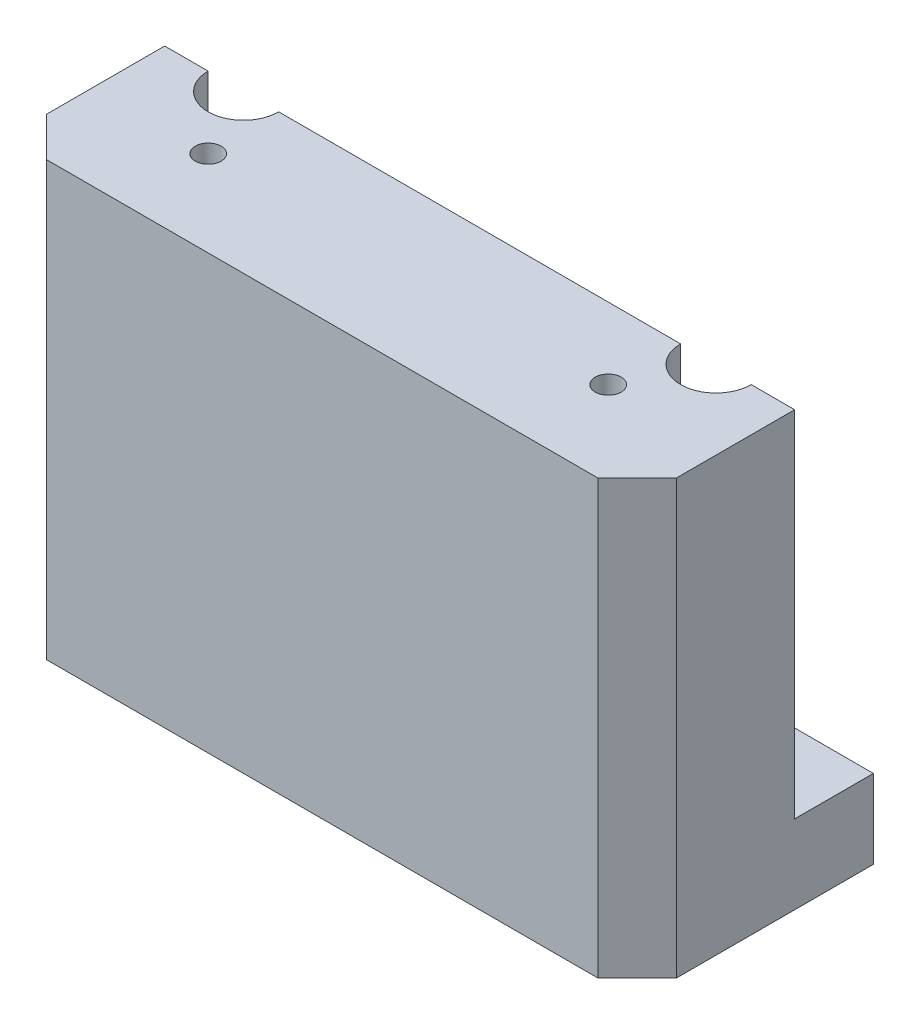
from build123d import *

# Parameters (mm, degrees)
SKETCH1_W                    = 80
SKETCH1_H                    = 30
BOSS_EXTRUDE1_DEPTH          = 55
CSK_FOR_M4_SFHCS1_AT_2_COUNT = 2
CSK_FOR_M4_SFHCS1_AT_2_PITCH = 60
M4X0_7_TAPPED_HOLE1_D        = 3.3
M4X0_7_TAPPED_HOLE1_DEPTH    = 20
M4X0_7_TAPPED_HOLE1_TIP      = 0.991420021
CHAMFER1_SIZE                = 5
SKETCH9_W                    = 80
SKETCH9_H                    = 45
CUT_EXTRUDE1_DEPTH           = 10


with BuildPart() as part:
    # Sketch1 → Boss-Extrude1 (new body)
    with BuildSketch(Plane(origin=(0, 0, 0), x_dir=(1, 0, 0), z_dir=(0, 1, 0))):
        Rectangle(SKETCH1_W, SKETCH1_H)
    extrude(amount=BOSS_EXTRUDE1_DEPTH)

    # Sketch5 → CSK for M4 SFHCS1 (revolve, cut)
    with BuildSketch(Plane(origin=(-30, 55, -5), x_dir=(0, 0, 1), z_dir=(1, 0, 0))):
        Polygon((0, 0), (0, 55), (2.25, 55), (2.25, 47.23), (4.48, 45), (4.48, 0), align=None)
    csk_for_m4_sfhcs1 = revolve(axis=Axis((-30, 61.35, -5), (0, -1, 0)), mode=Mode.SUBTRACT)

    # CSK for M4 SFHCS1 at 2: CSK for M4 SFHCS1 ×2
    with Locations(*[(i * CSK_FOR_M4_SFHCS1_AT_2_PITCH, 0, 0) for i in range(1, CSK_FOR_M4_SFHCS1_AT_2_COUNT)]):
        add(csk_for_m4_sfhcs1, mode=Mode.SUBTRACT)

    # M4x0.7 Tapped Hole1
    with Locations(Plane(origin=(0, 55, 0), x_dir=(1, 0, 0), z_dir=(0, 1, 0))):
        with Locations((-25.4, -4.078), (25.4, -4.078)):
            Hole(M4X0_7_TAPPED_HOLE1_D / 2, depth=M4X0_7_TAPPED_HOLE1_DEPTH)
            with Locations((0, 0, -(M4X0_7_TAPPED_HOLE1_DEPTH + M4X0_7_TAPPED_HOLE1_TIP / 2))):  # 118° drill point
                Cone(0, M4X0_7_TAPPED_HOLE1_D / 2, M4X0_7_TAPPED_HOLE1_TIP, mode=Mode.SUBTRACT)

    # Chamfer1
    chamfer1_edges = [part.edges().sort_by_distance(p)[0] for p in [
        (40, 27.5, 15),
        (-40, 27.5, 15),
    ]]
    chamfer(chamfer1_edges, length=CHAMFER1_SIZE)

    # Sketch9 → Cut-Extrude1 (cut)
    with BuildSketch(Plane(origin=(0, 0, -15), x_dir=(-1, 0, 0), z_dir=(0, 0, -1))):
        with Locations((0, 32.5)):
            Rectangle(SKETCH9_W, SKETCH9_H)
    extrude(amount=-CUT_EXTRUDE1_DEPTH, mode=Mode.SUBTRACT)


solid = part.part
